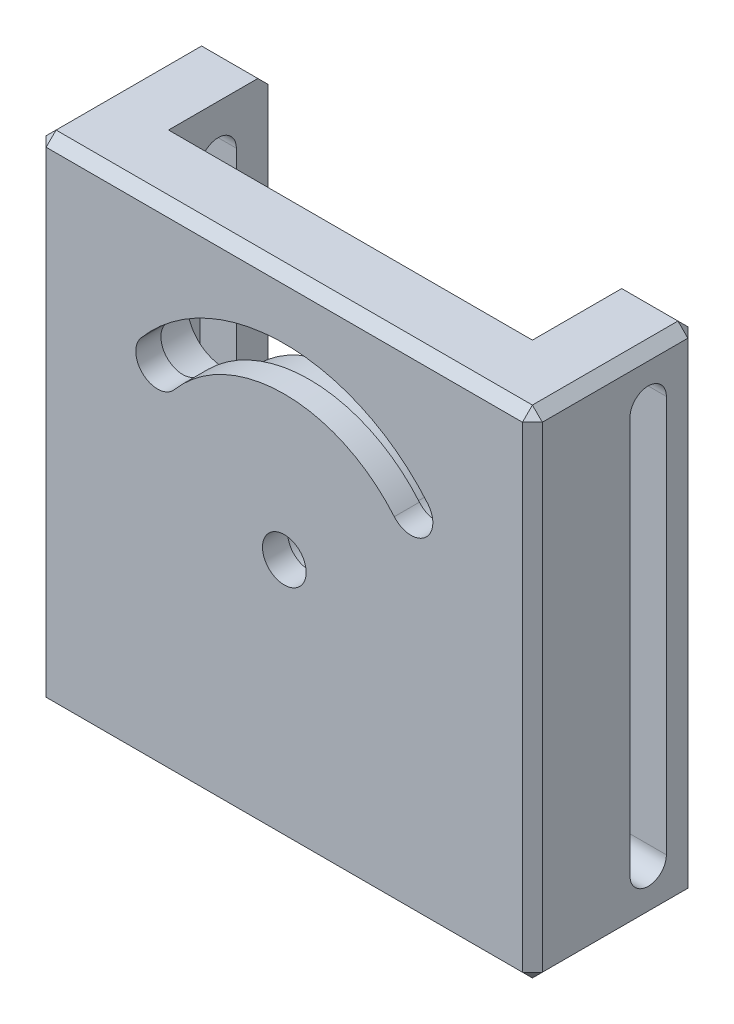
from build123d import *

# Parameters (mm, degrees)
SKETCH1_W                                           = 65
SKETCH1_H                                           = 75
BOSS_EXTRUDE1_DEPTH                                 = 10
SKETCH2_W                                           = 5
SKETCH2_H                                           = 75
BOSS_EXTRUDE2_DEPTH                                 = 15
CUT_EXTRUDE1_DEPTH                                  = 109
CUT_EXTRUDE3_DEPTH                                  = 6.2
CUT_EXTRUDE4_DEPTH                                  = 48.4
CBORE_FOR_M6_HEX_SOCKET_HEAD_CAP_SCREW1_D           = 6.6
CBORE_FOR_M6_HEX_SOCKET_HEAD_CAP_SCREW1_CBORE_D     = 11
CBORE_FOR_M6_HEX_SOCKET_HEAD_CAP_SCREW1_CBORE_DEPTH = 6.2
BOSS_EXTRUDE3_START                                 = 5
SKETCH9_W                                           = 25
SKETCH9_H                                           = 75
BOSS_EXTRUDE3_DEPTH                                 = 5
CHAMFER1_SIZE                                       = 1.5


with BuildPart() as part:
    # Sketch1 → Boss-Extrude1 (new body)
    with BuildSketch(Plane.XY):
        Rectangle(SKETCH1_W, SKETCH1_H)
    extrude(amount=BOSS_EXTRUDE1_DEPTH)

    # Sketch2 → Boss-Extrude2 (add)
    with BuildSketch(Plane(origin=(0, 0, 0), x_dir=(-1, 0, 0), z_dir=(0, 0, -1))):
        with Locations((-30, 0)):
            Rectangle(SKETCH2_W, SKETCH2_H)
        with Locations((30, 0)):
            Rectangle(SKETCH2_W, SKETCH2_H)
    extrude(amount=BOSS_EXTRUDE2_DEPTH)

    # Sketch3 → Cut-Extrude1 (cut)
    with BuildSketch(Plane.ZY.offset(32.5)):
        with BuildLine():
            Line((-4.75, 30), (-4.75, -30))
            ThreePointArc((-4.75, -30), (-7.5, -32.75), (-10.25, -30))
            Line((-10.25, -30), (-10.25, 30))
            ThreePointArc((-10.25, 30), (-7.5, 32.75), (-4.75, 30))
        make_face()
    extrude(amount=-CUT_EXTRUDE1_DEPTH, mode=Mode.SUBTRACT)

    # Sketch4 → Cut-Extrude3 (cut)
    with BuildSketch(Plane(origin=(0, 0, 0), x_dir=(-1, 0, 0), z_dir=(0, 0, -1))):
        with BuildLine():
            ThreePointArc((-23.364355515, 19.605022095), (-22.686442931, 11.856445805), (-14.937866641, 12.534358389))
            ThreePointArc((-14.937866641, 12.534358389), (0, 19.5), (14.937866641, 12.534358389))
            ThreePointArc((14.937866641, 12.534358389), (22.686442931, 11.856445805), (23.364355515, 19.605022095))
            ThreePointArc((23.364355515, 19.605022095), (0, 30.5), (-23.364355515, 19.605022095))
        make_face()
    extrude(amount=-CUT_EXTRUDE3_DEPTH, mode=Mode.SUBTRACT)

    # Sketch5 → Cut-Extrude4 (cut)
    with BuildSketch(Plane(origin=(0, 0, 0), x_dir=(-1, 0, 0), z_dir=(0, 0, -1))):
        with BuildLine():
            ThreePointArc((-21.67905774, 18.190889354), (-21.27231019, 13.54174358), (-16.623164416, 13.94849113))
            ThreePointArc((-16.623164416, 13.94849113), (0, 21.7), (16.623164416, 13.94849113))
            ThreePointArc((16.623164416, 13.94849113), (21.27231019, 13.54174358), (21.67905774, 18.190889354))
            ThreePointArc((21.67905774, 18.190889354), (0, 28.3), (-21.67905774, 18.190889354))
        make_face()
    extrude(amount=-CUT_EXTRUDE4_DEPTH, mode=Mode.SUBTRACT)

    # CBORE for M6 Hex Socket Head Cap Screw1 (through all)
    with Locations(Plane(origin=(0, 0, 0), x_dir=(-1, 0, 0), z_dir=(0, 0, -1))):
        with Locations((0, 0)):
            CounterBoreHole(CBORE_FOR_M6_HEX_SOCKET_HEAD_CAP_SCREW1_D / 2, CBORE_FOR_M6_HEX_SOCKET_HEAD_CAP_SCREW1_CBORE_D / 2, CBORE_FOR_M6_HEX_SOCKET_HEAD_CAP_SCREW1_CBORE_DEPTH)

    # Sketch9 → Boss-Extrude3 (add)
    with BuildSketch(Plane.ZY.offset(32.5).offset(BOSS_EXTRUDE3_START)):
        with Locations((-2.5, 0)):
            Rectangle(SKETCH9_W, SKETCH9_H)
        with BuildLine():
            Line((-4.75, 30), (-4.75, -30))
            ThreePointArc((-4.75, -30), (-7.5, -32.75), (-10.25, -30))
            Line((-10.25, -30), (-10.25, 30))
            ThreePointArc((-10.25, 30), (-7.5, 32.75), (-4.75, 30))
        make_face(mode=Mode.SUBTRACT)
    boss_extrude3 = extrude(amount=-BOSS_EXTRUDE3_DEPTH)

    # Mirror1: Boss-Extrude3 across plane
    add(boss_extrude3.mirror(Plane.ZY))

    # Chamfer1
    chamfer1_edges = [part.edges().sort_by_distance(p)[0] for p in [
        (-37.5, 0, -15),
        (-37.5, -37.5, -2.5),
        (-37.5, 0, 10),
        (-37.5, 37.5, -2.5),
        (37.5, 0, -15),
        (37.5, 37.5, -2.5),
        (37.5, 0, 10),
        (37.5, -37.5, -2.5),
        (0, -37.5, 10),
        (32.5, -37.5, -15),
        (32.5, 37.5, -15),
        (-32.5, 37.5, -15),
        (-32.5, -37.5, -15),
        (0, 37.5, 10),
    ]]
    chamfer(chamfer1_edges, length=CHAMFER1_SIZE)


solid = part.part
